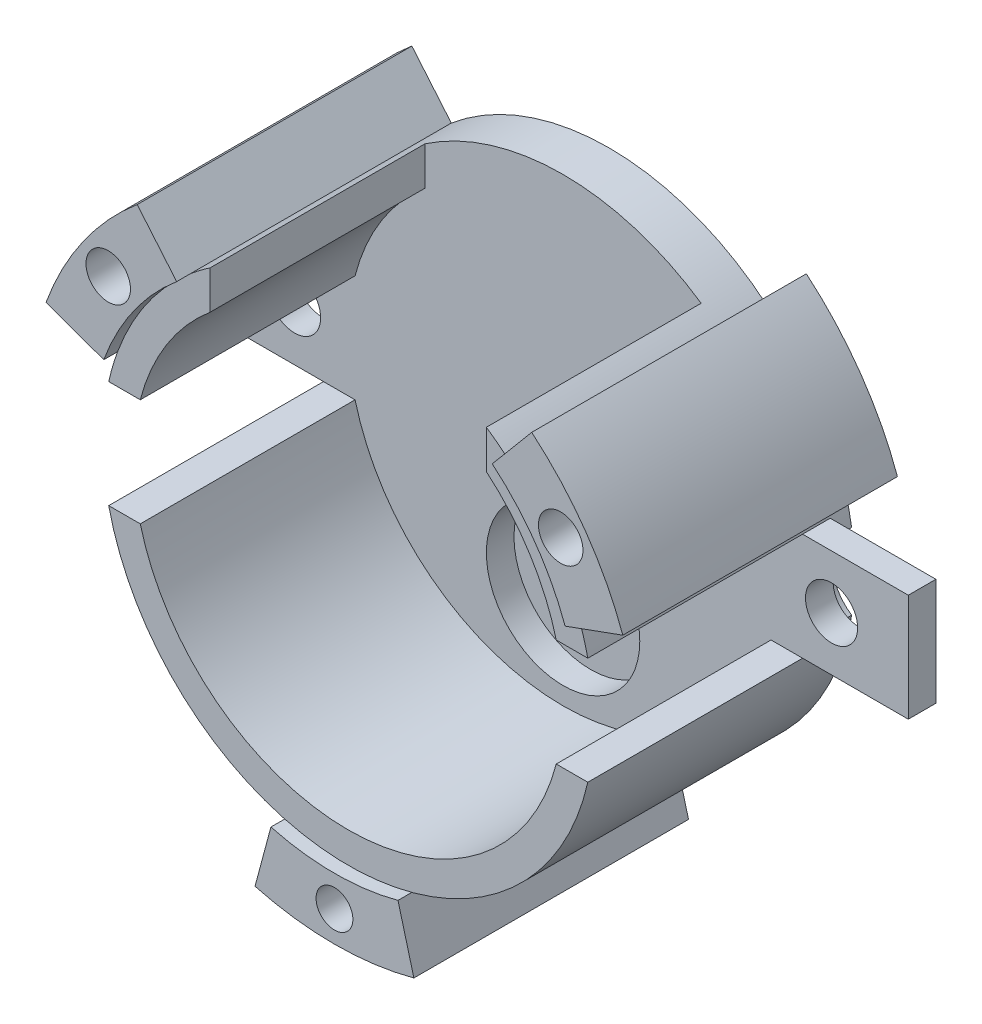
from build123d import *

# Parameters (mm, degrees)
SCHIZZO1_R                   = 16
SCHIZZO1_R_2                 = 14
ESTRUSIONE_ESTRUSIONE1_DEPTH = 14
ESTRUSIONE_ESTRUSIONE2_START = 3
SCHIZZO2_R                   = 16
ESTRUSIONE_ESTRUSIONE2_DEPTH = 3
SCHIZZO3_W                   = 32
SCHIZZO3_H                   = 7
TAGLIO_ESTRUSIONE1_DEPTH     = 14
SCHIZZO4_W                   = 45
SCHIZZO4_H                   = 7
ESTRUSIONE_ESTRUSIONE3_DEPTH = 1.8
SCHIZZO6_W                   = 18
SCHIZZO6_H                   = 16
TAGLIO_ESTRUSIONE2_DEPTH     = 14
SCHIZZO7_R                   = 5
TAGLIO_ESTRUSIONE3_DEPTH     = 1.8
ESTRUSIONE_ESTRUSIONE4_DEPTH = 17.9
ESTRUSIONE_ESTRUSIONE6_DEPTH = 17.9
SCHIZZO21_R                  = 3
TAGLIO_ESTRUSIONE4_DEPTH     = 10


with BuildPart() as part:
    # Schizzo1 → Estrusione-Estrusione1 (new body)
    with BuildSketch(Plane.XY):
        Circle(SCHIZZO1_R)
        Circle(SCHIZZO1_R_2, mode=Mode.SUBTRACT)
    extrude(amount=ESTRUSIONE_ESTRUSIONE1_DEPTH)

    # Schizzo2 → Estrusione-Estrusione2 (add)
    with BuildSketch(Plane(origin=(0, 0, 0), x_dir=(-1, 0, 0), z_dir=(0, 0, -1)).offset(ESTRUSIONE_ESTRUSIONE2_START)):
        Circle(SCHIZZO2_R)
    extrude(amount=-ESTRUSIONE_ESTRUSIONE2_DEPTH)

    # Schizzo3 → Taglio-Estrusione1 (cut)
    with BuildSketch(Plane.XY):
        Rectangle(SCHIZZO3_W, SCHIZZO3_H)
    extrude(amount=TAGLIO_ESTRUSIONE1_DEPTH, mode=Mode.SUBTRACT)

    # Schizzo4 → Estrusione-Estrusione3 (add)
    with BuildSketch(Plane.XY):
        Rectangle(SCHIZZO4_W, SCHIZZO4_H)
    extrude(amount=-ESTRUSIONE_ESTRUSIONE3_DEPTH)

    # Schizzo6 → Taglio-Estrusione2 (cut)
    with BuildSketch(Plane.XY):
        with Locations((0, 8)):
            Rectangle(SCHIZZO6_W, SCHIZZO6_H)
    extrude(amount=TAGLIO_ESTRUSIONE2_DEPTH, mode=Mode.SUBTRACT)

    # Schizzo7 → Taglio-Estrusione3 (cut)
    with BuildSketch(Plane.XY):
        with Locations((0, -7.85)):
            Circle(SCHIZZO7_R)
    extrude(amount=-TAGLIO_ESTRUSIONE3_DEPTH, mode=Mode.SUBTRACT)

    # Schizzo9 → Foro per Vite M3-1 (revolve, cut)
    with BuildSketch(Plane(origin=(17.5, 0, 0), x_dir=(0, -1, 0), z_dir=(1, 0, 0))):
        Polygon((0, 0), (0, 11.021463052), (1.7, 10), (1.7, 0), align=None)
    foro_per_vite_m3_1 = revolve(axis=Axis((17.5, 0, 6.35), (0, 0, -1)), mode=Mode.SUBTRACT)

    # Specchia1: Foro per Vite M3-1 across plane
    add(foro_per_vite_m3_1.mirror(Plane(origin=(0, 0, 0), x_dir=(0, 0, 1), z_dir=(1, 0, 0))), mode=Mode.SUBTRACT)

    # Schizzo11 → Estrusione-Estrusione4 (add)
    with BuildSketch(Plane(origin=(0, 0, -3), x_dir=(-1, 0, 0), z_dir=(0, 0, -1))):
        with BuildLine():
            Line((-10.284601755, 12.25671109), (-12.855752194, 15.320888862))
            ThreePointArc((-12.855752194, 15.320888862), (-16.383040886, 11.471528727), (-18.793852416, 6.840402867))
            Line((-18.793852416, 6.840402867), (-15.035081933, 5.472322293))
            ThreePointArc((-15.035081933, 5.472322293), (-13.106432709, 9.177222982), (-10.284601755, 12.25671109))
        make_face()
    estrusione_estrusione4 = extrude(amount=-ESTRUSIONE_ESTRUSIONE4_DEPTH)

    # Specchia2: Estrusione-Estrusione4 across plane
    add(estrusione_estrusione4.mirror(Plane(origin=(0, 0, 0), x_dir=(0, 0, 1), z_dir=(1, 0, 0))))

    # Schizzo16 → Foro per Vite M2.5-1 (revolve, cut)
    with BuildSketch(Plane(origin=(-14.744736797, 10.324375854, 14.9), x_dir=(0, -1, 0), z_dir=(1, 0, 0))):
        Polygon((0, 0), (0, 10.871247898), (1.45, 10), (1.45, 0), align=None)
    foro_per_vite_m2_5_1 = revolve(axis=Axis((-14.744736797, 10.324375854, 21.25), (0, 0, -1)), mode=Mode.SUBTRACT)

    # Specchia3: Foro per Vite M2.5-1 across plane
    add(foro_per_vite_m2_5_1.mirror(Plane(origin=(0, 0, 0), x_dir=(0, 0, 1), z_dir=(1, 0, 0))), mode=Mode.SUBTRACT)

    # Schizzo21 → Taglio-Estrusione4 (cut)
    with BuildSketch(Plane(origin=(0, 0, -1.8), x_dir=(-1, 0, 0), z_dir=(0, 0, -1))):
        with Locations((-17.5, 0)):
            Circle(SCHIZZO21_R)
        with Locations((17.5, 0)):
            Circle(SCHIZZO21_R)
    extrude(amount=TAGLIO_ESTRUSIONE4_DEPTH, mode=Mode.SUBTRACT)


with BuildPart() as body_2:
    # Schizzo13 → Estrusione-Estrusione6 (new body)
    with BuildSketch(Plane(origin=(0, 0, -3), x_dir=(-1, 0, 0), z_dir=(0, 0, -1))):
        with BuildLine():
            Line((-4.141104722, -15.454813221), (-5.176380902, -19.318516526))
            ThreePointArc((-5.176380902, -19.318516526), (0, -20), (5.176380902, -19.318516526))
            Line((5.176380902, -19.318516526), (4.141104722, -15.454813221))
            ThreePointArc((4.141104722, -15.454813221), (0, -16), (-4.141104722, -15.454813221))
        make_face()
    extrude(amount=-ESTRUSIONE_ESTRUSIONE6_DEPTH)

    # Schizzo20 → Foro per Vite M2-1 (revolve, cut)
    with BuildSketch(Plane(origin=(0, -18, 14.9), x_dir=(0, -1, 0), z_dir=(1, 0, 0))):
        Polygon((0, 0), (0, 10.721032743), (1.2, 10), (1.2, 0), align=None)
    revolve(axis=Axis((0, -18, 21.25), (0, 0, -1)), mode=Mode.SUBTRACT)


solid = Compound([part.part, body_2.part])
